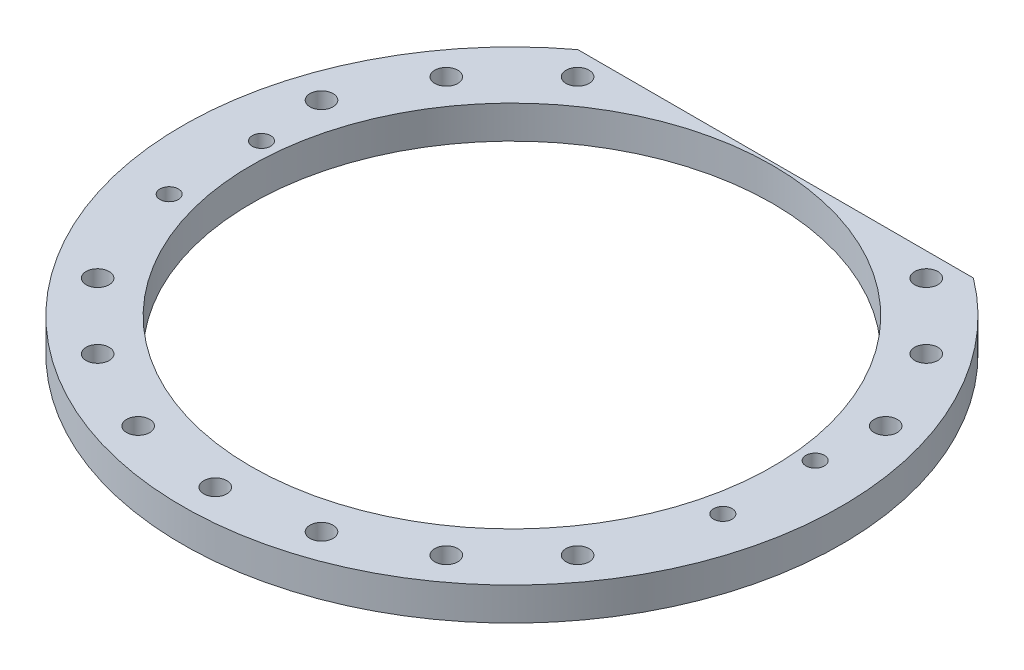
from build123d import *

# Parameters (mm, degrees)
SKETCH4_R           = 50
SKETCH4_R_2         = 39.565
SKETCH4_R_3         = 1.4
SKETCH4_R_4         = 1.75
BOSS_EXTRUDE3_DEPTH = 5
CUT_EXTRUDE1_START  = -40
SKETCH10_W          = 119.00246232
SKETCH10_H          = 31.760523389
CUT_EXTRUDE1_DEPTH  = 31.887234394


with BuildPart() as part:
    # Sketch4 → Boss-Extrude3 (new body)
    with BuildSketch(Plane(origin=(0, 0, 0), x_dir=(1, 0, 0), z_dir=(0, 1, 0))):
        Circle(SKETCH4_R)
        Circle(SKETCH4_R_2, mode=Mode.SUBTRACT)
        with Locations((42, -10)):
            Circle(SKETCH4_R_3, mode=Mode.SUBTRACT)
        with Locations((42, 4)):
            Circle(SKETCH4_R_3, mode=Mode.SUBTRACT)
        with Locations((-42, -10)):
            Circle(SKETCH4_R_3, mode=Mode.SUBTRACT)
        with Locations((-42, 4)):
            Circle(SKETCH4_R_3, mode=Mode.SUBTRACT)
        with Locations((0, -45)):
            Circle(SKETCH4_R_4, mode=Mode.SUBTRACT)
        with Locations((-13.905764747, -42.797543233)):
            Circle(SKETCH4_R_4, mode=Mode.SUBTRACT)
        with Locations((-26.450336353, -36.405764747)):
            Circle(SKETCH4_R_4, mode=Mode.SUBTRACT)
        with Locations((-36.405764747, -26.450336353)):
            Circle(SKETCH4_R_4, mode=Mode.SUBTRACT)
        with Locations((-42.797543233, 13.905764747)):
            Circle(SKETCH4_R_4, mode=Mode.SUBTRACT)
        with Locations((-36.405764747, 26.450336353)):
            Circle(SKETCH4_R_4, mode=Mode.SUBTRACT)
        with Locations((-26.450336353, 36.405764747)):
            Circle(SKETCH4_R_4, mode=Mode.SUBTRACT)
        with Locations((26.450336353, 36.405764747)):
            Circle(SKETCH4_R_4, mode=Mode.SUBTRACT)
        with Locations((36.405764747, 26.450336353)):
            Circle(SKETCH4_R_4, mode=Mode.SUBTRACT)
        with Locations((42.797543233, 13.905764747)):
            Circle(SKETCH4_R_4, mode=Mode.SUBTRACT)
        with Locations((36.405764747, -26.450336353)):
            Circle(SKETCH4_R_4, mode=Mode.SUBTRACT)
        with Locations((26.450336353, -36.405764747)):
            Circle(SKETCH4_R_4, mode=Mode.SUBTRACT)
        with Locations((13.905764747, -42.797543233)):
            Circle(SKETCH4_R_4, mode=Mode.SUBTRACT)
    extrude(amount=BOSS_EXTRUDE3_DEPTH)

    # Sketch10 → Cut-Extrude1 (cut, through all)
    with BuildSketch(Plane.XY.offset(CUT_EXTRUDE1_START)):
        with Locations((0.119400464, 6.241721298)):
            Rectangle(SKETCH10_W, SKETCH10_H)
    extrude(amount=-CUT_EXTRUDE1_DEPTH, mode=Mode.SUBTRACT)


solid = part.part
